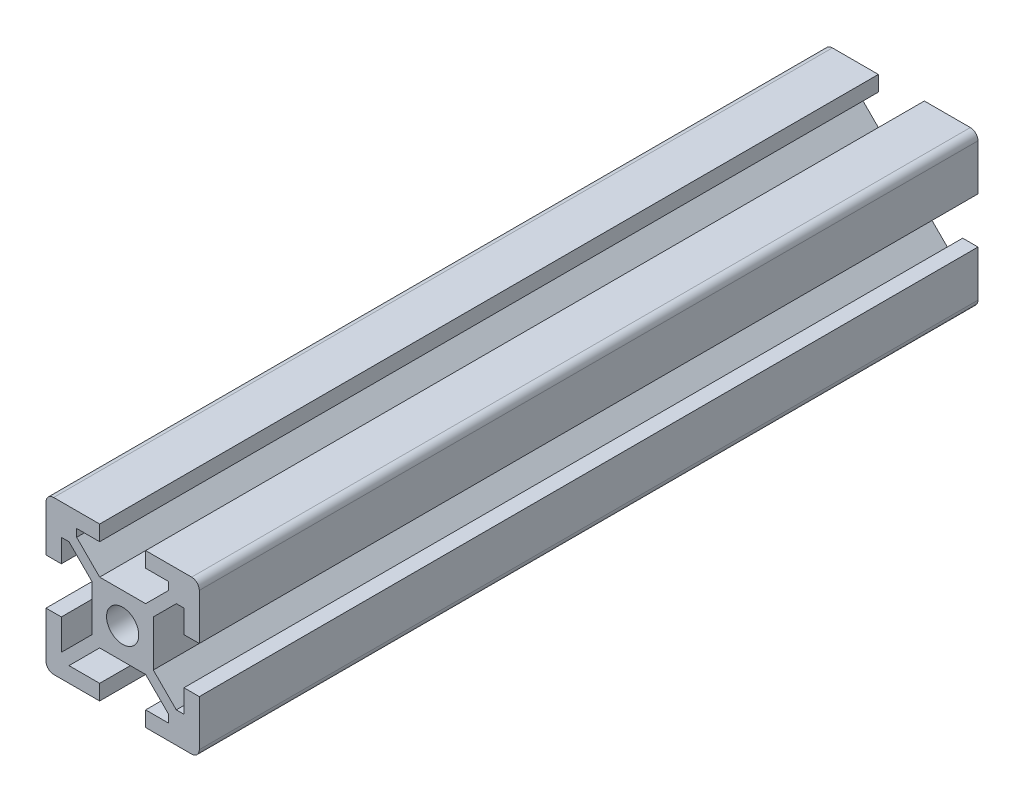
from build123d import *

# Parameters (mm, degrees)
SKETCH1_W           = 1
SKETCH1_H           = 1
SKETCH1_W_2         = 6
SKETCH1_H_2         = 6
SKETCH1_R           = 2.1
BOSS_EXTRUDE1_DEPTH = 101.6
FILLET1_R           = 1


with BuildPart() as part:
    # Sketch1 → Boss-Extrude1 (new body)
    # profile 1 of 35: a face of its own
    with BuildSketch(Plane.XY):
        Polygon((-6, 7), (-6, 8), (-7, 8), align=None)
    # profile 2 of 35: a face of its own
    with BuildSketch(Plane.XY):
        Polygon((-6, 7), (-7, 8), (-8, 8), (-8, 7), (-7, 6), (-6, 6), align=None)
    # profile 3 of 35: a face of its own
    with BuildSketch(Plane.XY):
        Polygon((-8, 7), (-8, 6), (-7, 6), align=None)
    # profile 4 of 35: a face of its own
    with BuildSketch(Plane.XY):
        Polygon((-3, 8), (-3, 10), (-10, 10), (-10, 3), (-8, 3), (-8, 6), (-8, 7), (-8, 8), (-7, 8), (-6, 8), align=None)
    # profile 5 of 35: a face of its own
    with BuildSketch(Plane.XY):
        Polygon((-6, 5), (-6, 6), (-7, 6), align=None)
    # profile 6 of 35: a face of its own
    with BuildSketch(Plane.XY):
        Polygon((-6, 6), (-5, 6), (-6, 7), align=None)
    # profile 7 of 35: a face of its own
    with BuildSketch(Plane.XY):
        Polygon((-3, 4), (-5, 6), (-6, 6), (-6, 5), (-4, 3), (-4, 4), align=None)
    # profile 8 of 35: a face of its own
    with BuildSketch(Plane.XY):
        with Locations((-3.5, 3.5)):
            Rectangle(SKETCH1_W, SKETCH1_H)
    # profile 9 of 35: a face of its own
    with BuildSketch(Plane.XY):
        with Locations((0, 3.5)):
            Rectangle(SKETCH1_W_2, SKETCH1_H)
    # profile 10 of 35: a face of its own
    with BuildSketch(Plane.XY):
        with Locations((-3.5, 0)):
            Rectangle(SKETCH1_W, SKETCH1_H_2)
    # profile 11 of 35: a face of its own
    with BuildSketch(Plane.XY):
        Rectangle(SKETCH1_W_2, SKETCH1_H_2)
        Circle(SKETCH1_R, mode=Mode.SUBTRACT)
    # profile 12 of 35: a face of its own
    with BuildSketch(Plane.XY):
        with Locations((3.5, 3.5)):
            Rectangle(SKETCH1_W, SKETCH1_H)
    # profile 13 of 35: a face of its own
    with BuildSketch(Plane.XY):
        Polygon((6, 6), (5, 6), (3, 4), (4, 4), (4, 3), (6, 5), align=None)
    # profile 14 of 35: a face of its own
    with BuildSketch(Plane.XY):
        Polygon((6, 7), (5, 6), (6, 6), align=None)
    # profile 15 of 35: a face of its own
    with BuildSketch(Plane.XY):
        Polygon((6, 6), (6, 5), (7, 6), align=None)
    # profile 16 of 35: a face of its own
    with BuildSketch(Plane.XY):
        Polygon((8, 8), (7, 8), (6, 7), (6, 6), (7, 6), (8, 7), align=None)
    # profile 17 of 35: a face of its own
    with BuildSketch(Plane.XY):
        Polygon((7, 8), (6, 8), (6, 7), align=None)
    # profile 18 of 35: a face of its own
    with BuildSketch(Plane.XY):
        Polygon((7, 6), (8, 6), (8, 7), align=None)
    # profile 19 of 35: a face of its own
    with BuildSketch(Plane.XY):
        Polygon((10, 3), (10, 10), (3, 10), (3, 8), (6, 8), (7, 8), (8, 8), (8, 7), (8, 6), (8, 3), align=None)
    # profile 20 of 35: a face of its own
    with BuildSketch(Plane.XY):
        with Locations((3.5, 0)):
            Rectangle(SKETCH1_W, SKETCH1_H_2)
    # profile 21 of 35: a face of its own
    with BuildSketch(Plane.XY):
        with Locations((3.5, -3.5)):
            Rectangle(SKETCH1_W, SKETCH1_H)
    # profile 22 of 35: a face of its own
    with BuildSketch(Plane.XY):
        Polygon((6, -6), (6, -5), (4, -3), (4, -4), (3, -4), (5, -6), align=None)
    # profile 23 of 35: a face of its own
    with BuildSketch(Plane.XY):
        Polygon((7, -6), (6, -5), (6, -6), align=None)
    # profile 24 of 35: a face of its own
    with BuildSketch(Plane.XY):
        Polygon((6, -7), (6, -6), (5, -6), align=None)
    # profile 25 of 35: a face of its own
    with BuildSketch(Plane.XY):
        Polygon((8, -8), (8, -7), (7, -6), (6, -6), (6, -7), (7, -8), align=None)
    # profile 26 of 35: a face of its own
    with BuildSketch(Plane.XY):
        Polygon((6, -7), (6, -8), (7, -8), align=None)
    # profile 27 of 35: a face of its own
    with BuildSketch(Plane.XY):
        Polygon((8, -7), (8, -6), (7, -6), align=None)
    # profile 28 of 35: a face of its own
    with BuildSketch(Plane.XY):
        Polygon((10, -10), (10, -3), (8, -3), (8, -6), (8, -7), (8, -8), (7, -8), (6, -8), (3, -8), (3, -10), align=None)
    # profile 29 of 35: a face of its own
    with BuildSketch(Plane.XY):
        with Locations((0, -3.5)):
            Rectangle(SKETCH1_W_2, SKETCH1_H)
    # profile 30 of 35: a face of its own
    with BuildSketch(Plane.XY):
        with Locations((-3.5, -3.5)):
            Rectangle(SKETCH1_W, SKETCH1_H)
    # profile 31 of 35: a face of its own
    with BuildSketch(Plane.XY):
        Polygon((-4, -3), (-6, -5), (-6, -6), (-5, -6), (-3, -4), (-4, -4), align=None)
    # profile 32 of 35: a face of its own
    with BuildSketch(Plane.XY):
        Polygon((-6, -7), (-5, -6), (-6, -6), align=None)
    # profile 33 of 35: a face of its own
    with BuildSketch(Plane.XY):
        Polygon((-6, -6), (-6, -5), (-7, -6), align=None)
    # profile 34 of 35: a face of its own
    with BuildSketch(Plane.XY):
        Polygon((-7, -6), (-8, -7), (-8, -8), (-7, -8), (-6, -7), (-6, -6), align=None)
    # profile 35 of 35: a face of its own
    with BuildSketch(Plane.XY):
        Polygon((-8, -3), (-10, -3), (-10, -10), (-3, -10), (-3, -8), (-6, -8), (-7, -8), (-8, -8), (-8, -7), (-8, -6), align=None)
    extrude(amount=BOSS_EXTRUDE1_DEPTH)

    # Fillet1
    fillet1_edges = [part.edges().sort_by_distance(p)[0] for p in [
        (-10, -10, 50.8),
        (-10, 10, 50.8),
        (10, 10, 50.8),
        (10, -10, 50.8),
    ]]
    fillet(fillet1_edges, radius=FILLET1_R)


solid = part.part
